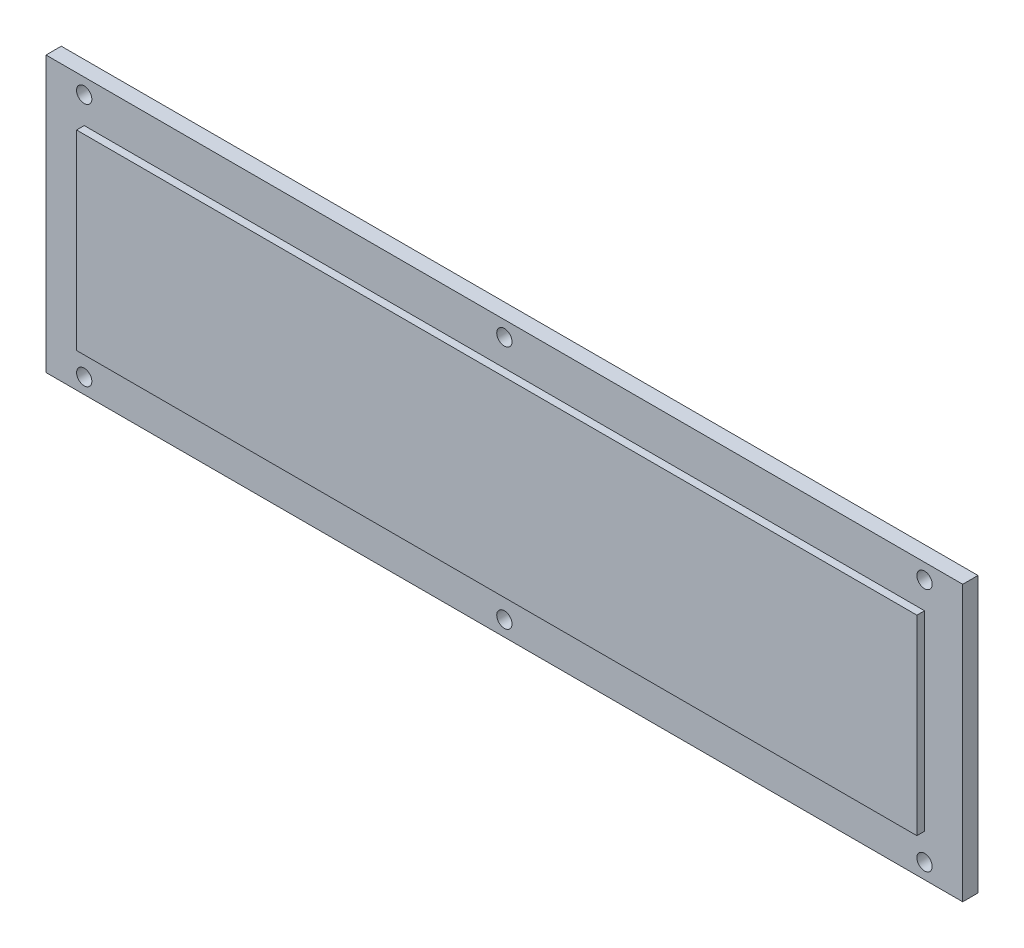
from build123d import *

# Parameters (mm, degrees)
SKETCH1_W           = 120
SKETCH1_H           = 36
BOSS_EXTRUDE1_DEPTH = 2
SKETCH2_W           = 110
SKETCH2_H           = 25
BOSS_EXTRUDE2_DEPTH = 1
SKETCH3_R           = 1
CUT_EXTRUDE1_DEPTH  = 63.673758464
SKETCH4_R           = 1
CUT_EXTRUDE2_DEPTH  = 10


with BuildPart() as part:
    # Sketch1 → Boss-Extrude1 (new body)
    with BuildSketch(Plane.XY):
        Rectangle(SKETCH1_W, SKETCH1_H)
    extrude(amount=BOSS_EXTRUDE1_DEPTH)

    # Sketch2 → Boss-Extrude2 (add)
    with BuildSketch(Plane.XY.offset(2)):
        Rectangle(SKETCH2_W, SKETCH2_H)
    extrude(amount=BOSS_EXTRUDE2_DEPTH)

    # Sketch3 → Cut-Extrude1 (cut, through all)
    with BuildSketch(Plane.XY.offset(2)):
        with Locations((-55, 16)):
            Circle(SKETCH3_R)
        with Locations((-55, -16)):
            Circle(SKETCH3_R)
        with Locations((55, 16)):
            Circle(SKETCH3_R)
        with Locations((55, -16)):
            Circle(SKETCH3_R)
    extrude(amount=-CUT_EXTRUDE1_DEPTH, mode=Mode.SUBTRACT)

    # Sketch4 → Cut-Extrude2 (cut)
    with BuildSketch(Plane(origin=(0, 0, 0), x_dir=(-1, 0, 0), z_dir=(0, 0, -1))):
        with Locations((0, 16)):
            Circle(SKETCH4_R)
        with Locations((0, -16)):
            Circle(SKETCH4_R)
    extrude(amount=-CUT_EXTRUDE2_DEPTH, mode=Mode.SUBTRACT)


solid = part.part
